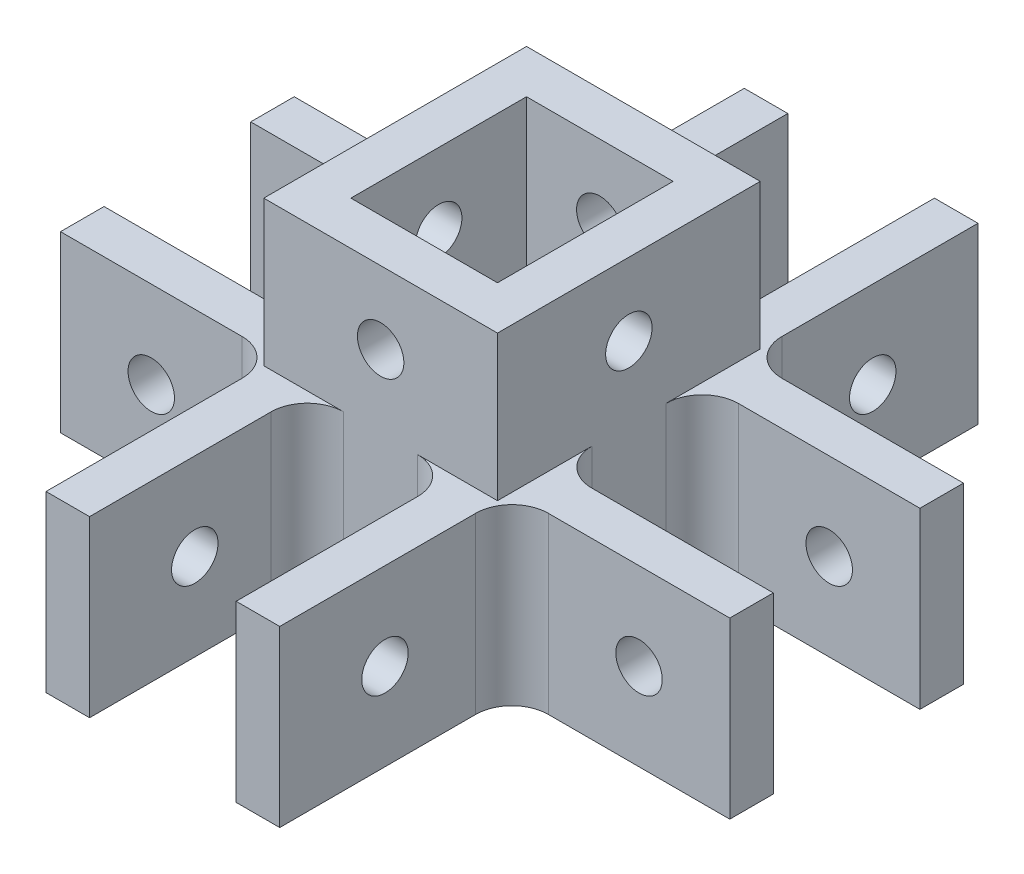
from build123d import *

# Parameters (mm, degrees)
ESQUISSE2_W               = 10.1
ESQUISSE2_H               = 12.1
BOSS_EXTRU_1_DEPTH        = 12
ENL_V_MAT_EXTRU_1_REACH   = 46.317
ESQUISSE3_R               = 1.6
SYM_TRIE6_COPY_1_REACH    = 46.317
SYM_TRIE6_COPY_1_SKETCH_R = 1.6
ESQUISSE4_W               = 16.1
ESQUISSE4_H               = 18.1
ESQUISSE4_W_2             = 10.1
ESQUISSE4_H_2             = 12.1
EXTRU_MINCE1_DEPTH        = 10
ESQUISSE5_R               = 1.6
ENL_V_MAT_EXTRU_2_DEPTH   = 49.674634051


with BuildPart() as part:
    # Esquisse2 → Boss.-Extru.1 (new body)
    with BuildSketch(Plane(origin=(0, 0, 0), x_dir=(1, 0, 0), z_dir=(0, 1, 0))):
        with BuildLine():
            Line((0, 11.55), (0, 24.05))
            Line((0, 24.05), (-3, 24.05))
            Line((-3, 24.05), (-3, 10.55))
            ThreePointArc((-3, 10.55), (-3.732233047, 8.782233047), (-5.5, 8.05))
            Line((-5.5, 8.05), (-18, 8.05))
            Line((-18, 8.05), (-18, 5.05))
            Line((-18, 5.05), (-5.5, 5.05))
            ThreePointArc((-5.5, 5.05), (-3.732233047, 4.317766953), (-3, 2.55))
            Line((-3, 2.55), (-3, -2.55))
            ThreePointArc((-3, -2.55), (-3.732233047, -4.317766953), (-5.5, -5.05))
            Line((-5.5, -5.05), (-18, -5.05))
            Line((-18, -5.05), (-18, -8.05))
            Line((-18, -8.05), (-5.5, -8.05))
            ThreePointArc((-5.5, -8.05), (-3.732233047, -8.782233047), (-3, -10.55))
            Line((-3, -10.55), (-3, -24.05))
            Line((-3, -24.05), (0, -24.05))
            Line((0, -24.05), (0, -11.55))
            ThreePointArc((0, -11.55), (0.732233047, -9.782233047), (2.5, -9.05))
            Line((2.5, -9.05), (7.6, -9.05))
            ThreePointArc((7.6, -9.05), (9.367766953, -9.782233047), (10.1, -11.55))
            Line((10.1, -11.55), (10.1, -24.05))
            Line((10.1, -24.05), (13.1, -24.05))
            Line((13.1, -24.05), (13.1, -10.55))
            ThreePointArc((13.1, -10.55), (13.832233047, -8.782233047), (15.6, -8.05))
            Line((15.6, -8.05), (28.1, -8.05))
            Line((28.1, -8.05), (28.1, -5.05))
            Line((28.1, -5.05), (15.6, -5.05))
            ThreePointArc((15.6, -5.05), (13.832233047, -4.317766953), (13.1, -2.55))
            Line((13.1, -2.55), (13.1, 2.55))
            ThreePointArc((13.1, 2.55), (13.832233047, 4.317766953), (15.6, 5.05))
            Line((15.6, 5.05), (28.1, 5.05))
            Line((28.1, 5.05), (28.1, 8.05))
            Line((28.1, 8.05), (15.6, 8.05))
            ThreePointArc((15.6, 8.05), (13.832233047, 8.782233047), (13.1, 10.55))
            Line((13.1, 10.55), (13.1, 24.05))
            Line((13.1, 24.05), (10.1, 24.05))
            Line((10.1, 24.05), (10.1, 11.55))
            ThreePointArc((10.1, 11.55), (9.367766953, 9.782233047), (7.6, 9.05))
            Line((7.6, 9.05), (2.5, 9.05))
            ThreePointArc((2.5, 9.05), (0.732233047, 9.782233047), (0, 11.55))
        make_face()
        with Locations((5.05, 0)):
            Rectangle(ESQUISSE2_W, ESQUISSE2_H, mode=Mode.SUBTRACT)
    extrude(amount=BOSS_EXTRU_1_DEPTH)

    # Enlèv. mat.-Extru.1: up to this face of the body (flat: up to its plane)
    enl_v_mat_extru_1_end = Plane(part.part.faces().sort_by_distance((-11.75, 6, -8.05))[0])
    # Esquisse3 → Enlèv. mat.-Extru.1 (cut, up to the picked face)
    with BuildSketch(Plane.XY.offset(8.05), mode=Mode.PRIVATE) as enl_v_mat_extru_1_sk1:
        with Locations((-11.75, 6)):
            Circle(ESQUISSE3_R)
    enl_v_mat_extru_1_tool1 = split(extrude(enl_v_mat_extru_1_sk1.sketch, amount=-ENL_V_MAT_EXTRU_1_REACH, mode=Mode.PRIVATE), bisect_by=enl_v_mat_extru_1_end, keep=Keep.BOTH, mode=Mode.PRIVATE)
    enl_v_mat_extru_1 = enl_v_mat_extru_1_tool1.solids().sort_by(Axis((-11.75, 6, 8.05), (0, 0, -1)))[0]
    add(enl_v_mat_extru_1, mode=Mode.SUBTRACT)

    # Symétrie1: Enlèv. mat.-Extru.1 across plane
    add(enl_v_mat_extru_1.mirror(Plane(origin=(5.05, 0, 0), x_dir=(0, 0, 1), z_dir=(1, 0, 0))), mode=Mode.SUBTRACT)

    # Symétrie6: Enlèv. mat.-Extru.1 across plane
    add(enl_v_mat_extru_1.mirror(Plane(origin=(2.525, 0, -2.525), x_dir=(0.7071067811865478, 0, 0.7071067811865472), z_dir=(-0.7071067811865475, 0, 0.7071067811865477))), mode=Mode.SUBTRACT)

    # Symétrie6 copy 1: up to this face of the body (flat: up to its plane)
    sym_trie6_copy_1_end = Plane(part.part.faces().sort_by_distance((-3, 6, 16.8))[0])
    # Symétrie6 copy 1 sketch → Symétrie6 copy 1 (cut, up to the picked face)
    with BuildSketch(Plane(origin=(13.1, 0, 5.05), x_dir=(0, 0, -1), z_dir=(1, 0, 0)), mode=Mode.PRIVATE) as sym_trie6_copy_1_sk1:
        with Locations((-11.75, 6)):
            Circle(SYM_TRIE6_COPY_1_SKETCH_R)
    sym_trie6_copy_1_tool1 = split(extrude(sym_trie6_copy_1_sk1.sketch, amount=-SYM_TRIE6_COPY_1_REACH, mode=Mode.PRIVATE), bisect_by=sym_trie6_copy_1_end, keep=Keep.BOTH, mode=Mode.PRIVATE)
    add(sym_trie6_copy_1_tool1.solids().sort_by(Axis((13.1, 6, 16.8), (-1, 0, 0)))[0], mode=Mode.SUBTRACT)

    # Esquisse4 → Extru.-Mince1 (add)
    with BuildSketch(Plane(origin=(0, 12, 0), x_dir=(1, 0, 0), z_dir=(0, 1, 0))):
        with Locations((5.05, 0)):
            Rectangle(ESQUISSE4_W, ESQUISSE4_H)
        with Locations((5.05, 0)):
            Rectangle(ESQUISSE4_W_2, ESQUISSE4_H_2, mode=Mode.SUBTRACT)
    extrude(amount=EXTRU_MINCE1_DEPTH)

    # Esquisse5 → Enlèv. mat.-Extru.2 (cut, through all)
    with BuildSketch(Plane(origin=(0, 0, -9.05), x_dir=(-1, 0, 0), z_dir=(0, 0, -1))):
        with Locations((-5.05, 17)):
            Circle(ESQUISSE5_R)
    enl_v_mat_extru_2 = extrude(amount=-ENL_V_MAT_EXTRU_2_DEPTH, mode=Mode.SUBTRACT)

    # Symétrie10: Enlèv. mat.-Extru.2 across plane
    add(enl_v_mat_extru_2.mirror(Plane(origin=(2.525, 0, -2.525), x_dir=(0.7071067811865478, 0, 0.7071067811865472), z_dir=(-0.7071067811865475, 0, 0.7071067811865477))), mode=Mode.SUBTRACT)


solid = part.part
